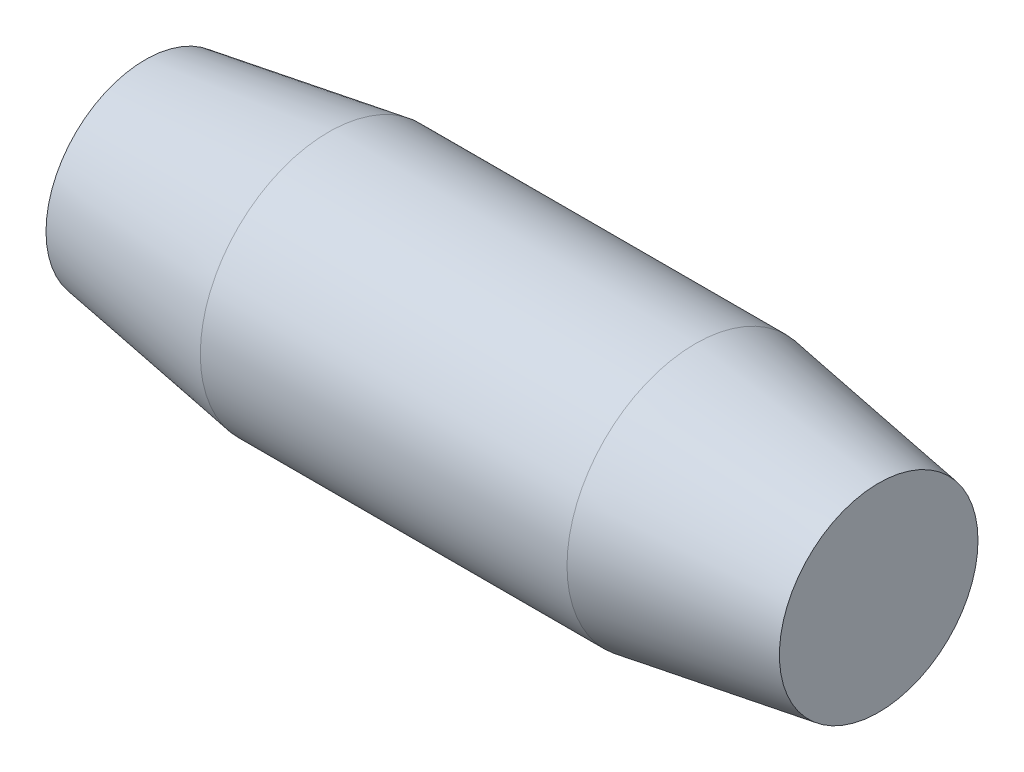
from build123d import *

# Parameters (mm, degrees)
SKETCH1_R           = 6.6675
BOSS_EXTRUDE1_DEPTH = 9.525
SKETCH3_R           = 6.6675
BOSS_EXTRUDE2_DEPTH = 9.525
BOSS_EXTRUDE2_TAPER = 9


with BuildPart() as part:
    # Sketch1 → Boss-Extrude1 (new, symmetric)
    with BuildSketch(Plane(origin=(0, 0, 0), x_dir=(0, 0, -1), z_dir=(1, 0, 0))):
        with Locations(Location((0, 0, 0), (0, 0, 180))):
            Circle(SKETCH1_R)
    extrude(amount=BOSS_EXTRUDE1_DEPTH, both=True)

    # Sketch3 → Boss-Extrude2 (add)
    with BuildSketch(Plane(origin=(9.525, 0, 0), x_dir=(0, 0, -1), z_dir=(1, 0, 0))):
        with Locations(Location((0, 0, 0), (0, 0, 180))):
            Circle(SKETCH3_R)
    boss_extrude2 = extrude(amount=BOSS_EXTRUDE2_DEPTH, taper=BOSS_EXTRUDE2_TAPER)

    # Mirror1: Boss-Extrude2 across plane
    add(boss_extrude2.mirror(Plane(origin=(0, 0, 0), x_dir=(0, 0, 1), z_dir=(1, 0, 0))))


solid = part.part
